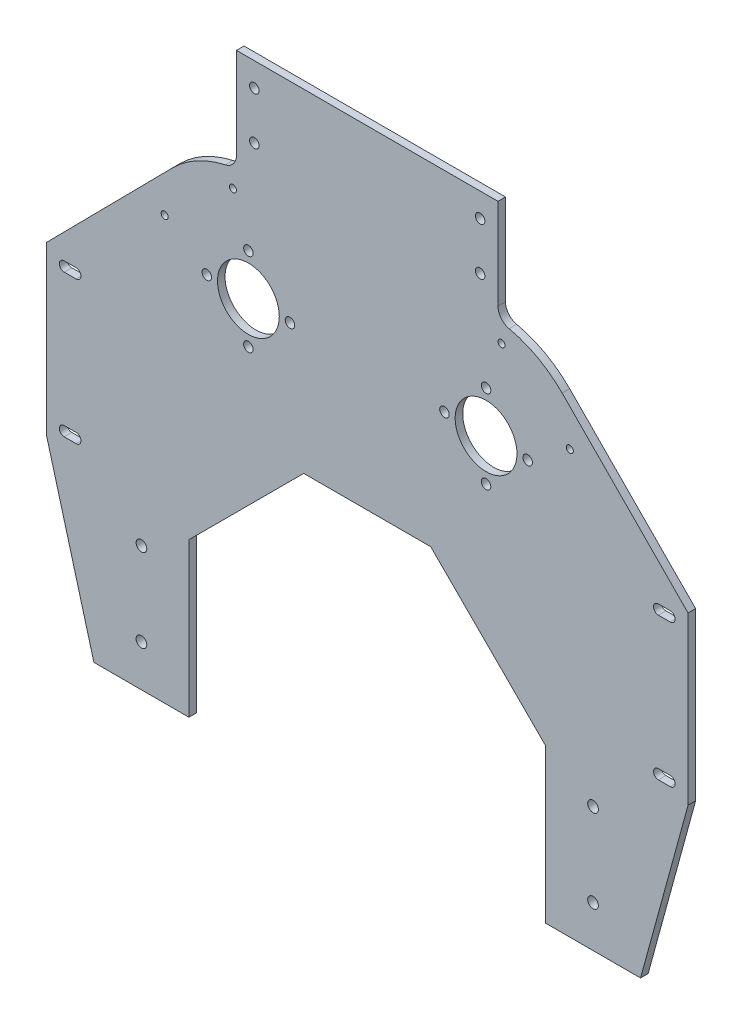
from build123d import *

# Parameters (mm, degrees)
SKETCH1_W           = 110
SKETCH1_H           = 140
SKETCH1_R           = 2
BOSS_EXTRUDE1_DEPTH = 3.175
SKETCH2_R           = 2.25
BOSS_EXTRUDE2_DEPTH = 3.175
SKETCH3_R           = 45
SKETCH3_R_2         = 2
SKETCH3_R_3         = 13
SKETCH3_R_4         = 1.4732
BOSS_EXTRUDE3_DEPTH = 3.175
BOSS_EXTRUDE5_DEPTH = 3.175
FILLET1_R           = 6
SKETCH6_R           = 2
SKETCH6_R_2         = 13
CUT_EXTRUDE1_DEPTH  = 10


with BuildPart() as part:
    # Sketch1 → Boss-Extrude1 (new body)
    with BuildSketch(Plane.XY):
        Rectangle(SKETCH1_W, SKETCH1_H)
        with Locations((-47.5, 40)):
            Circle(SKETCH1_R, mode=Mode.SUBTRACT)
        with Locations((47.5, 40)):
            Circle(SKETCH1_R, mode=Mode.SUBTRACT)
        with Locations((-47.5, 60)):
            Circle(SKETCH1_R, mode=Mode.SUBTRACT)
        with Locations((47.5, 60)):
            Circle(SKETCH1_R, mode=Mode.SUBTRACT)
    extrude(amount=BOSS_EXTRUDE1_DEPTH)

    # Sketch2 → Boss-Extrude2 (add)
    with BuildSketch(Plane.XY):
        Polygon((-26.715730122, -70), (-55, -41.715730122), (-115, -101.715728753), (-115, -183), (-75, -183), (-75, -118.28427098), align=None)
        with Locations((-95, -165.5)):
            Circle(SKETCH2_R, mode=Mode.SUBTRACT)
        with Locations((-95, -130.5)):
            Circle(SKETCH2_R, mode=Mode.SUBTRACT)
    boss_extrude2 = extrude(amount=BOSS_EXTRUDE2_DEPTH)

    # Mirror1: Boss-Extrude2 across plane
    add(boss_extrude2.mirror(Plane(origin=(0, 0, 0), x_dir=(0, 0, 1), z_dir=(1, 0, 0))))

    # Sketch3 → Boss-Extrude3 (add)
    # profile 1 of 2: a face of its own
    with BuildSketch(Plane.XY.offset(3.175)):
        with Locations((-50, -18)):
            Circle(SKETCH3_R)
        with Locations((-67.5, -18)):
            Circle(SKETCH3_R_2, mode=Mode.SUBTRACT)
        with Locations((-50, -18)):
            Circle(SKETCH3_R_3, mode=Mode.SUBTRACT)
        with Locations((-56.511806663, 18.930290738)):
            Circle(SKETCH3_R_4, mode=Mode.SUBTRACT)
        with Locations((-85.238473279, -5.174244625)):
            Circle(SKETCH3_R_4, mode=Mode.SUBTRACT)
    # profile 2 of 2: a face of its own
    with BuildSketch(Plane.XY.offset(3.175)):
        with Locations((50, -18)):
            Circle(SKETCH3_R)
        with Locations((67.5, -18)):
            Circle(SKETCH3_R_2, mode=Mode.SUBTRACT)
        with Locations((50, -18)):
            Circle(SKETCH3_R_3, mode=Mode.SUBTRACT)
        with Locations((56.511806663, 18.930290738)):
            Circle(SKETCH3_R_4, mode=Mode.SUBTRACT)
        with Locations((85.238473279, -5.174244625)):
            Circle(SKETCH3_R_4, mode=Mode.SUBTRACT)
    extrude(amount=-BOSS_EXTRUDE3_DEPTH)

    # Sketch4 → Boss-Extrude5 (add)
    with BuildSketch(Plane.XY.offset(3.175)):
        with BuildLine():
            Line((-60, -101.715728753), (-60, -40))
            Line((-60, -40), (-89.255572853, -40))
            ThreePointArc((-89.255572853, -40), (-94.594805712, -11.97477772), (-82.00977873, 13.628690546))
            Line((-82.00977873, 13.628690546), (-135, -40))
            Line((-135, -40), (-135, -110))
            Line((-135, -110), (-115, -183))
            Line((-115, -183), (-115, -101.715728753))
            Line((-115, -101.715728753), (-60, -101.715728753))
        make_face()
        with BuildLine():
            Line((-127.5, -102.95), (-122.5, -102.95))
            ThreePointArc((-122.5, -102.95), (-120.45, -105), (-122.5, -107.05))
            Line((-122.5, -107.05), (-127.5, -107.05))
            ThreePointArc((-127.5, -107.05), (-129.55, -105), (-127.5, -102.95))
        make_face(mode=Mode.SUBTRACT)
        with BuildLine():
            ThreePointArc((-122.5, -42.95), (-120.45, -45), (-122.5, -47.05))
            Line((-122.5, -47.05), (-127.5, -47.05))
            ThreePointArc((-127.5, -47.05), (-129.55, -45), (-127.5, -42.95))
            Line((-127.5, -42.95), (-122.5, -42.95))
        make_face(mode=Mode.SUBTRACT)
    boss_extrude5 = extrude(amount=-BOSS_EXTRUDE5_DEPTH)

    # Mirror2: Boss-Extrude5 across plane
    add(boss_extrude5.mirror(Plane(origin=(0, 0, 0), x_dir=(0, 0, 1), z_dir=(1, 0, 0))))

    # Fillet1
    fillet1_edges = [part.edges().sort_by_distance(p)[0] for p in [
        (-55, 26.72135955, 1.5875),
        (55, 26.72135955, 1.5875),
    ]]
    fillet(fillet1_edges, radius=FILLET1_R)

    # Sketch6 → Cut-Extrude1 (cut)
    with BuildSketch(Plane.XY.offset(3.175)):
        with Locations((32.5, -18)):
            Circle(SKETCH6_R)
        with Locations((50, -0.5)):
            Circle(SKETCH6_R)
        with Locations((67.5, -18)):
            Circle(SKETCH6_R)
        with Locations((50, -18)):
            Circle(SKETCH6_R_2)
        with Locations((50, -35.5)):
            Circle(SKETCH6_R)
        with Locations((-50, -18)):
            Circle(SKETCH6_R_2)
        with Locations((-67.5, -18)):
            Circle(SKETCH6_R)
        with Locations((-50, -35.5)):
            Circle(SKETCH6_R)
        with Locations((-32.5, -18)):
            Circle(SKETCH6_R)
        with Locations((-50, -0.5)):
            Circle(SKETCH6_R)
    extrude(amount=-CUT_EXTRUDE1_DEPTH, mode=Mode.SUBTRACT)


solid = part.part
